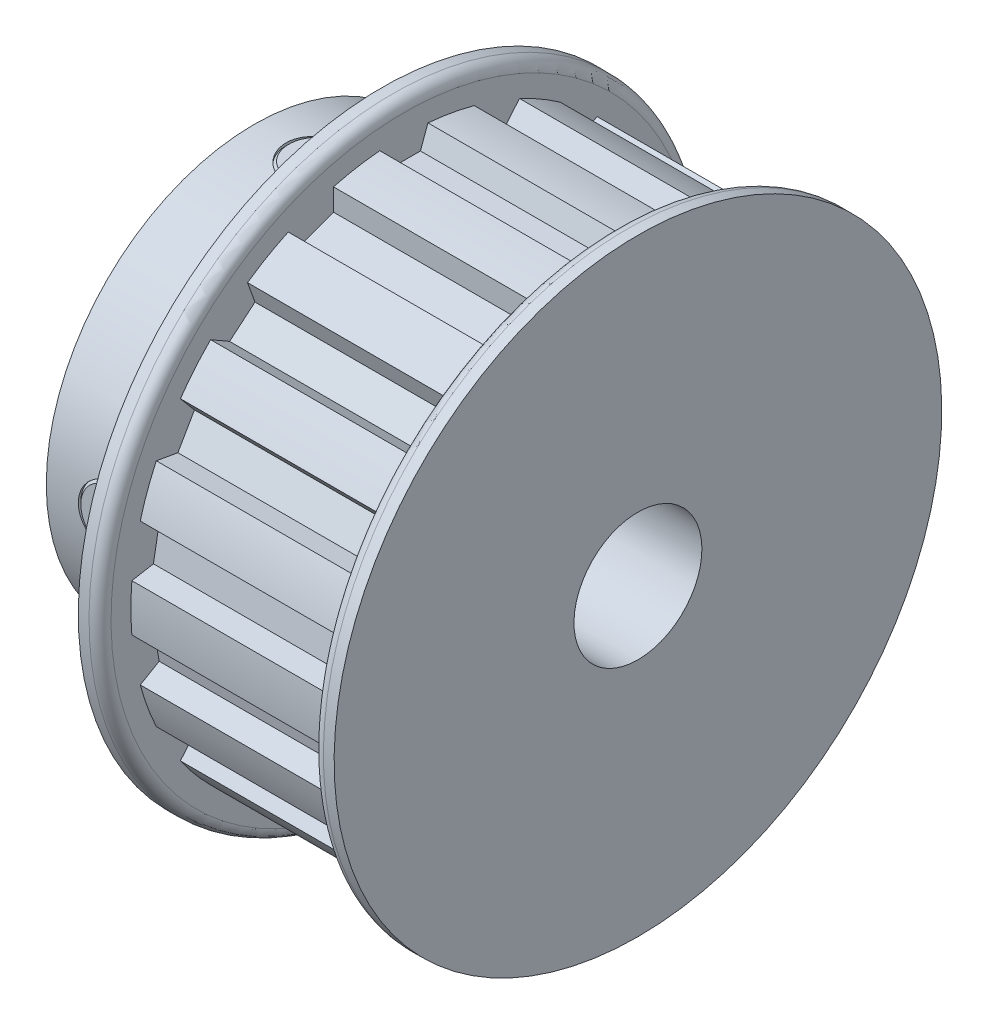
from build123d import *

# Parameters (mm, degrees)
SKETCH4_R          = 27.2923
SKETCH4_R_2        = 27.1012539
CUT_EXTRUDE2_DEPTH = 21.082
CUT_EXTRUDE1_DEPTH = 21.082
CIRPATTERN1_COUNT  = 18
SKETCH6_R          = 3.175
CUT_EXTRUDE3_DEPTH = 47.716756228
CUT_EXTRUDE4_DEPTH = 2.032
CIRPATTERN2_COUNT  = 2
CIRPATTERN2_ANGLE  = 90
CIRPATTERN3_COUNT  = 2
CIRPATTERN3_ANGLE  = 90


with BuildPart() as part:
    # Sketch1 → Revolve1 (revolve)
    with BuildSketch(Plane.XY, mode=Mode.PRIVATE) as revolve1_sk:
        with BuildLine():
            Line((-19.05, 6.35), (19.05, 6.35))
            Line((19.05, 6.35), (19.05, 30.1625))
            Line((19.05, 30.1625), (17.9832, 30.1625))
            ThreePointArc((17.9832, 30.1625), (17.210897974, 29.842602026), (16.891, 29.0703))
            Line((16.891, 29.0703), (16.891, 27.2923))
            Line((16.891, 27.2923), (-4.191, 27.2923))
            Line((-4.191, 27.2923), (-4.191, 29.0703))
            ThreePointArc((-4.191, 29.0703), (-4.510897974, 29.842602026), (-5.2832, 30.1625))
            Line((-5.2832, 30.1625), (-6.35, 30.1625))
            Line((-6.35, 30.1625), (-6.35, 20.6375))
            Line((-6.35, 20.6375), (-19.05, 20.6375))
            Line((-19.05, 20.6375), (-19.05, 6.35))
        make_face()
    revolve(revolve1_sk.sketch.rotate(Axis((-19.05, 0, 0), (1, 0, 0)), 180), axis=Axis((-19.05, 0, 0), (1, 0, 0)))

    # Sketch4 → Cut-Extrude2 (cut)
    with BuildSketch(Plane(origin=(-4.191, 0, 0), x_dir=(0, 0, -1), z_dir=(1, 0, 0))):
        Circle(SKETCH4_R)
        with Locations(Location((0, 0, 0), (0, 0, 90))):
            Circle(SKETCH4_R_2, mode=Mode.SUBTRACT)
    extrude(amount=CUT_EXTRUDE2_DEPTH, mode=Mode.SUBTRACT)

    # Sketch3 → Cut-Extrude1 (cut)
    with BuildSketch(Plane(origin=(-4.191, 0, 0), x_dir=(0, 0, -1), z_dir=(1, 0, 0))):
        with BuildLine():
            Line((-2.391743806, 26.99550934), (-1.647556394, 24.950871228))
            Line((-1.647556394, 24.950871228), (1.647556394, 24.950871228))
            Line((1.647556394, 24.950871228), (2.391743806, 26.99550934))
            ThreePointArc((2.391743806, 26.99550934), (0, 27.1012539), (-2.391743806, 26.99550934))
        make_face()
    cut_extrude1 = extrude(amount=CUT_EXTRUDE1_DEPTH, mode=Mode.SUBTRACT)

    # CirPattern1: Cut-Extrude1 ×18 about axis
    cirpattern1_axis = Axis((0, 0, 0), (1, 0, 0))
    for i in range(1, CIRPATTERN1_COUNT):
        add(cut_extrude1.rotate(cirpattern1_axis, i * 360 / CIRPATTERN1_COUNT), mode=Mode.SUBTRACT)

    # Sketch6 → Cut-Extrude3 (cut, through all)
    with BuildSketch(Plane(origin=(0, 0, 0), x_dir=(1, 0, 0), z_dir=(0, 1, 0))):
        with Locations(Location((-12.7, 0, 0), (0, 0, 90))):
            Circle(SKETCH6_R)
    cut_extrude3 = extrude(amount=CUT_EXTRUDE3_DEPTH, mode=Mode.SUBTRACT)

    # CirPattern2: Cut-Extrude3 ×2 about axis
    cirpattern2_axis = Axis((-19.05, 0, 0), (1, 0, 0))
    for i in range(1, CIRPATTERN2_COUNT):
        add(cut_extrude3.rotate(cirpattern2_axis, i * CIRPATTERN2_ANGLE / (CIRPATTERN2_COUNT - 1)), mode=Mode.SUBTRACT)


with BuildPart() as body_2:
    # Sketch7 → Revolve2 (revolve)
    with BuildSketch(Plane.XY, mode=Mode.PRIVATE) as revolve2_sk:
        Polygon((-15.621, 20.6375), (-12.7, 20.6375), (-12.7, 6.731), (-15.621, 6.731), (-15.875, 6.985), (-15.875, 20.3835), align=None)
    revolve(revolve2_sk.sketch.rotate(Axis((-12.7, 6.731, 0), (0, 1, 0)), 270), axis=Axis((-12.7, 6.731, 0), (0, 1, 0)))

    # Sketch8 → Cut-Extrude4 (cut)
    with BuildSketch(Plane(origin=(0, 20.6375, 0), x_dir=(1, 0, 0), z_dir=(0, 1, 0))):
        Polygon((-12.7, 1.833087105), (-14.2875, 0.916543552), (-14.2875, -0.916543552), (-12.7, -1.833087105), (-11.1125, -0.916543552), (-11.1125, 0.916543552), align=None)
    extrude(amount=-CUT_EXTRUDE4_DEPTH, mode=Mode.SUBTRACT)


with BuildPart() as cirpattern3_1:
    # CirPattern3: pattern copy
    add(body_2.part.rotate(Axis((0, 0, 0), (1, 0, 0)), 1 * CIRPATTERN3_ANGLE / (CIRPATTERN3_COUNT - 1)))


solid = Compound([part.part, body_2.part, cirpattern3_1.part])
